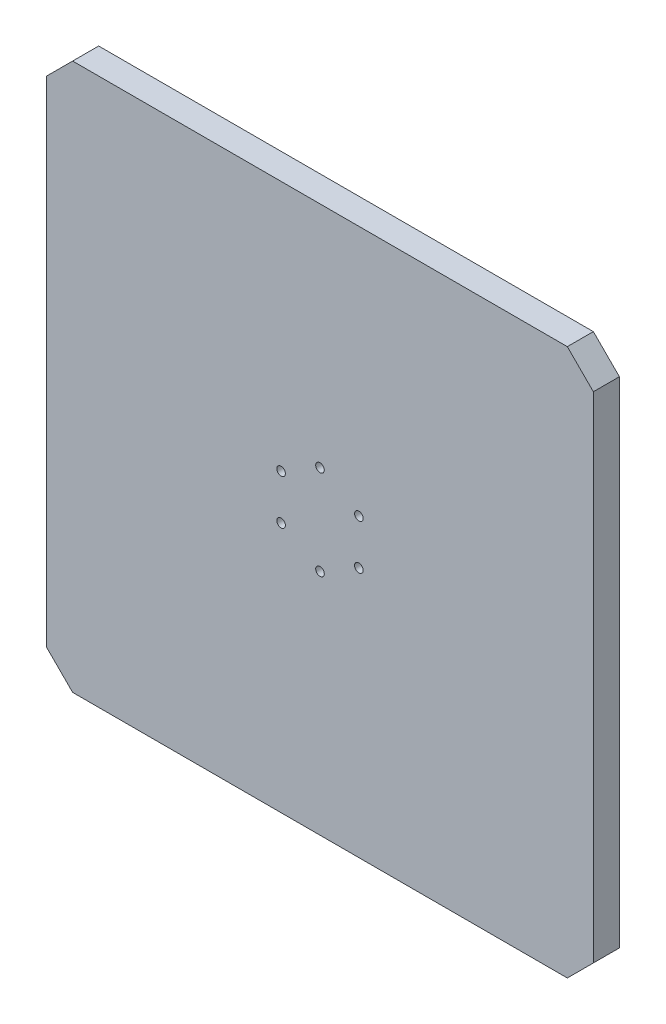
from build123d import *

# Parameters (mm, degrees)
SKETCH_1_W               = 150
SKETCH_1_H               = 150
EXTRUDE_1_DEPTH          = 30
SKETCH_2_R               = 48.25
EXTRUDE_2_DEPTH          = 10
SKETCH_3_R               = 1.65
EXTRUDE_3_DEPTH          = 8.3
SKETCH_4_W               = 150
SKETCH_4_H               = 30
EXTRUDE_4_DEPTH          = 30
SKETCH_5_W               = 30
SKETCH_5_H               = 180
EXTRUDE_5_DEPTH          = 30
SKETCH_6_W               = 180
SKETCH_6_H               = 30
EXTRUDE_6_DEPTH          = 30
SKETCH_7_W               = 30
SKETCH_7_H               = 210
EXTRUDE_7_DEPTH          = 30
CHAMFER_1_SIZE           = 10
CUT_EXTRUDE_1_DEPTH      = 154.785564992
CUT_EXTRUDE_1_DEPTH_BACK = 154.785564992
SKETCH_8_R               = 1.65
CUT_EXTRUDE_START        = -15
SKETCH_9_R               = 48.25
CUT_EXTRUDE_2_DEPTH      = 15
SKETCH_10_R              = 48.25
CUT_EXTRUDE_3_DEPTH      = 15
CUT_EXTRUDE_START_2      = -5
SKETCH_11_R              = 48.25
CUT_EXTRUDE_4_DEPTH      = 5
SKETCH_12_R              = 48.25
CUT_EXTRUDE_5_DEPTH      = 5


with BuildPart() as part:
    # 草图1 → 凸台-拉伸1 (new body)
    with BuildSketch(Plane.XY):
        Rectangle(SKETCH_1_W, SKETCH_1_H)
    extrude(amount=EXTRUDE_1_DEPTH)

    # 草图2 → 凸台-拉伸2 (add)
    with BuildSketch(Plane(origin=(0, 0, 0), x_dir=(-1, 0, 0), z_dir=(0, 0, -1))):
        Circle(SKETCH_2_R)
    extrude(amount=EXTRUDE_2_DEPTH)

    # 草图3 → 凸台-拉伸3 (add)
    with BuildSketch(Plane(origin=(0, 0, -10), x_dir=(-1, 0, 0), z_dir=(0, 0, -1))):
        with Locations(Location((0, 17.25, 0), (0, 0, 180))):
            Circle(SKETCH_3_R)
        with Locations(Location((14.938938215, 8.625, 0), (0, 0, 180))):
            Circle(SKETCH_3_R)
        with Locations(Location((14.938938215, -8.625, 0), (0, 0, 180))):
            Circle(SKETCH_3_R)
        with Locations(Location((0, -17.25, 0), (0, 0, 180))):
            Circle(SKETCH_3_R)
        with Locations(Location((-14.938938215, -8.625, 0), (0, 0, 180))):
            Circle(SKETCH_3_R)
        with Locations(Location((-14.938938215, 8.625, 0), (0, 0, 180))):
            Circle(SKETCH_3_R)
    extrude(amount=EXTRUDE_3_DEPTH)

    # 草图4 → 凸台-拉伸4 (add)
    with BuildSketch(Plane(origin=(0, 75, 0), x_dir=(1, 0, 0), z_dir=(0, 1, 0))):
        with Locations((0, -15)):
            Rectangle(SKETCH_4_W, SKETCH_4_H)
    extrude(amount=EXTRUDE_4_DEPTH)

    # 草图5 → 凸台-拉伸5 (add)
    with BuildSketch(Plane.ZY.offset(75)):
        with Locations((15, 15)):
            Rectangle(SKETCH_5_W, SKETCH_5_H)
    extrude(amount=EXTRUDE_5_DEPTH)

    # 草图6 → 凸台-拉伸6 (add)
    with BuildSketch(Plane.XZ.offset(75)):
        with Locations((-15, 15)):
            Rectangle(SKETCH_6_W, SKETCH_6_H)
    extrude(amount=EXTRUDE_6_DEPTH)

    # 草图7 → 凸台-拉伸7 (add)
    with BuildSketch(Plane(origin=(75, 0, 0), x_dir=(0, 0, -1), z_dir=(1, 0, 0))):
        with Locations((-15, 0)):
            Rectangle(SKETCH_7_W, SKETCH_7_H)
    extrude(amount=EXTRUDE_7_DEPTH)

    # 倒角1
    chamfer_1_edges = [part.edges().sort_by_distance(p)[0] for p in [
        (-105, 105, 15),
        (-105, -105, 15),
        (105, -105, 15),
        (105, 105, 15),
    ]]
    chamfer(chamfer_1_edges, length=CHAMFER_1_SIZE)

    # 草图8 → 切除-拉伸1 (cut, two sides: drawn at the far end of the back side and taken through both)
    with BuildSketch(Plane(origin=(0, 0, -10), x_dir=(-1, 0, 0), z_dir=(0, 0, -1)).offset(-CUT_EXTRUDE_1_DEPTH_BACK)):
        with Locations((-14.938938215, -8.625)):
            Circle(SKETCH_8_R)
        with Locations((0, -17.25)):
            Circle(SKETCH_8_R)
        with Locations((14.938938215, -8.625)):
            Circle(SKETCH_8_R)
        with Locations((14.938938215, 8.625)):
            Circle(SKETCH_8_R)
        with Locations((0, 17.25)):
            Circle(SKETCH_8_R)
        with Locations((-14.938938215, 8.625)):
            Circle(SKETCH_8_R)
    extrude(amount=CUT_EXTRUDE_1_DEPTH + CUT_EXTRUDE_1_DEPTH_BACK, mode=Mode.SUBTRACT)

    # 草图9 → 切除-拉伸2 (cut)
    with BuildSketch(Plane(origin=(0, 0, 0), x_dir=(-1, 0, 0), z_dir=(0, 0, -1)).offset(CUT_EXTRUDE_START)):
        Polygon((-95, -105), (95, -105), (105, -95), (105, 95), (95, 105), (-95, 105), (-105, 95), (-105, -95), align=None)
        Circle(SKETCH_9_R, mode=Mode.SUBTRACT)
    extrude(amount=CUT_EXTRUDE_2_DEPTH, mode=Mode.SUBTRACT)

    # 草图10 → 切除-拉伸3 (cut)
    with BuildSketch(Plane(origin=(0, 0, -10), x_dir=(-1, 0, 0), z_dir=(0, 0, -1)).offset(CUT_EXTRUDE_START)):
        Circle(SKETCH_10_R)
    extrude(amount=CUT_EXTRUDE_3_DEPTH, mode=Mode.SUBTRACT)

    # 草图11 → 切除-拉伸4 (cut)
    with BuildSketch(Plane(origin=(0, 0, 5), x_dir=(-1, 0, 0), z_dir=(0, 0, -1)).offset(CUT_EXTRUDE_START_2)):
        Circle(SKETCH_11_R)
    extrude(amount=CUT_EXTRUDE_4_DEPTH, mode=Mode.SUBTRACT)

    # 草图12 → 切除-拉伸5 (cut)
    with BuildSketch(Plane(origin=(0, 0, 15), x_dir=(-1, 0, 0), z_dir=(0, 0, -1)).offset(CUT_EXTRUDE_START_2)):
        Polygon((-105, -95), (-95, -105), (95, -105), (105, -95), (105, 95), (95, 105), (-95, 105), (-105, 95), align=None)
        Circle(SKETCH_12_R, mode=Mode.SUBTRACT)
    extrude(amount=CUT_EXTRUDE_5_DEPTH, mode=Mode.SUBTRACT)


solid = part.part
